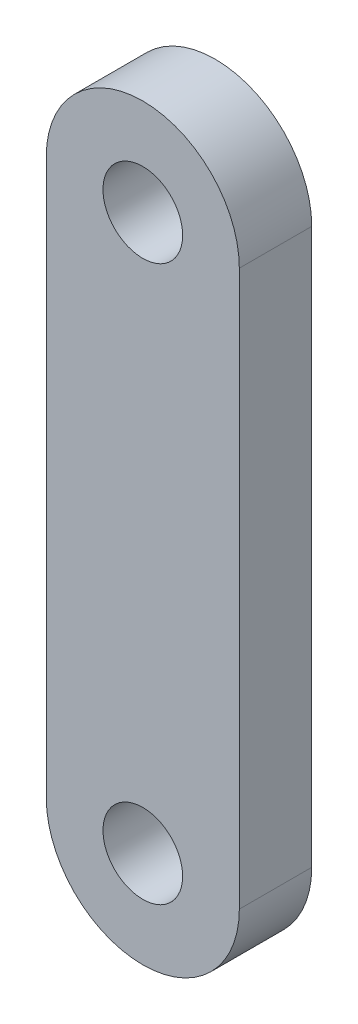
from build123d import *

# Parameters (mm, degrees)
SKETCH_1_R      = 1.65
EXTRUDE_1_DEPTH = 3


with BuildPart() as part:
    # 草图1 → 凸台-拉伸1 (new body)
    with BuildSketch(Plane.XY):
        with BuildLine():
            Line((4, 11.5), (4, -11.5))
            ThreePointArc((4, -11.5), (0, -15.5), (-4, -11.5))
            Line((-4, -11.5), (-4, 11.5))
            ThreePointArc((-4, 11.5), (0, 15.5), (4, 11.5))
        make_face()
        with Locations((0, 11.5)):
            Circle(SKETCH_1_R, mode=Mode.SUBTRACT)
        with Locations((0, -11.5)):
            Circle(SKETCH_1_R, mode=Mode.SUBTRACT)
    extrude(amount=EXTRUDE_1_DEPTH)


solid = part.part
